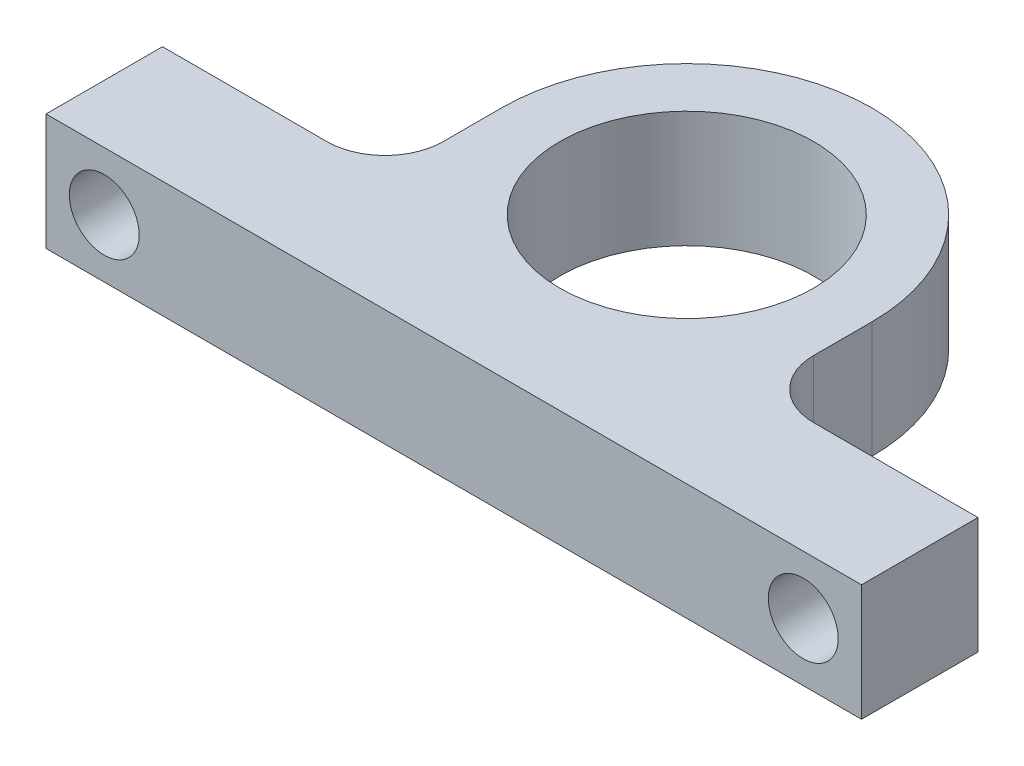
from build123d import *

# Parameters (mm, degrees)
SKETCH1_R           = 10.9
BOSS_EXTRUDE1_DEPTH = 10
FILLET1_R           = 5
SKETCH2_R           = 3
CUT_EXTRUDE1_DEPTH  = 45.674489365


with BuildPart() as part:
    # Sketch1 → Boss-Extrude1 (new body)
    with BuildSketch(Plane(origin=(0, 0, 0), x_dir=(1, 0, 0), z_dir=(0, 1, 0))):
        with BuildLine():
            Line((35, 0), (-35, 0))
            Line((-35, 0), (-35, 10))
            Line((-35, 10), (-15.9, 10))
            Line((-15.9, 10), (-15.9, 20))
            ThreePointArc((-15.9, 20), (0, 35.9), (15.9, 20))
            Line((15.9, 20), (15.9, 10))
            Line((15.9, 10), (35, 10))
            Line((35, 10), (35, 0))
        make_face()
        with Locations(Location((0, 20, 0), (0, 0, 270))):
            Circle(SKETCH1_R, mode=Mode.SUBTRACT)
    extrude(amount=BOSS_EXTRUDE1_DEPTH)

    # Fillet1
    fillet1_edges = [part.edges().sort_by_distance(p)[0] for p in [
        (15.9, 5, -10),
        (-15.9, 5, -10),
    ]]
    fillet(fillet1_edges, radius=FILLET1_R)

    # Sketch2 → Cut-Extrude1 (cut, through all)
    with BuildSketch(Plane(origin=(0, 0, -10), x_dir=(-1, 0, 0), z_dir=(0, 0, -1))):
        with Locations((-30, 5)):
            Circle(SKETCH2_R)
        with Locations((30, 5)):
            Circle(SKETCH2_R)
    extrude(amount=-CUT_EXTRUDE1_DEPTH, mode=Mode.SUBTRACT)


solid = part.part
